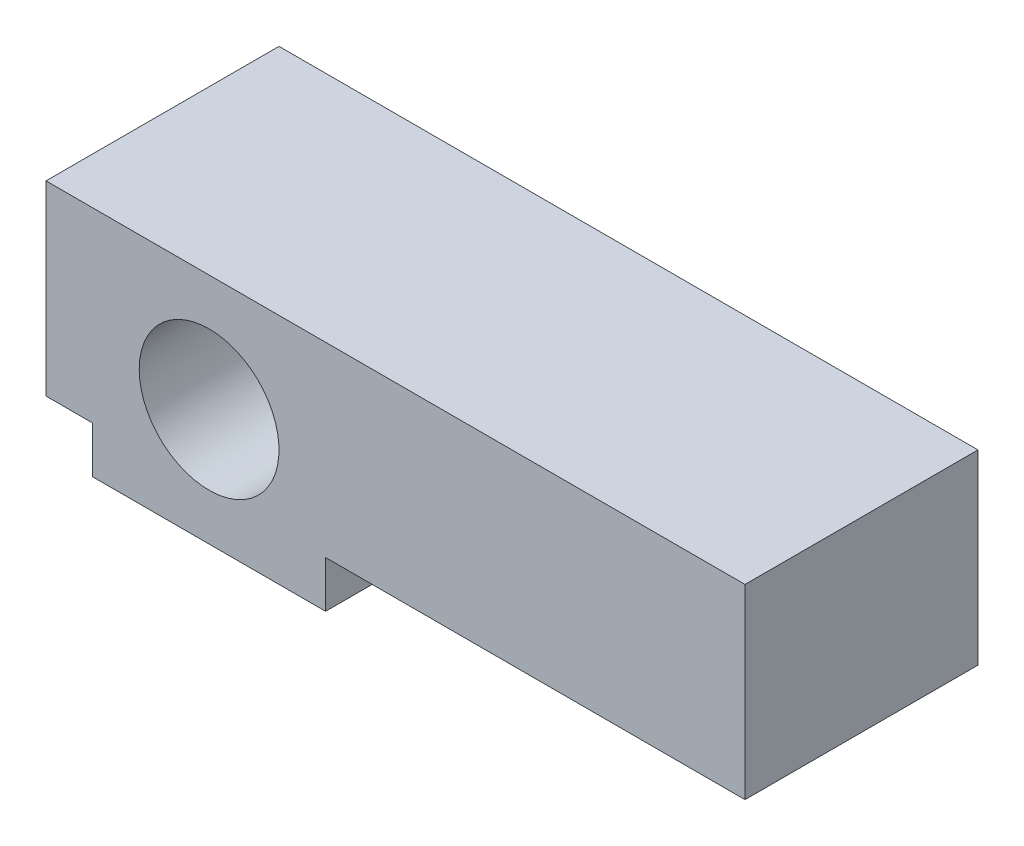
from build123d import *

# Parameters (mm, degrees)
EXTRUDE_1_DEPTH     = 10
CUT_EXTRUDE_1_REACH = 21.9
SKETCH_3_R          = 3
SKETCH_4_W          = 10
SKETCH_4_H          = 8
EXTRUDE_2_DEPTH     = 16


with BuildPart() as part:
    # 草图2 → 凸台-拉伸1 (new body)
    with BuildSketch(Plane(origin=(0, 0, 95), x_dir=(-1, 0, 0), z_dir=(0, 0, -1))):
        Polygon((2, -10), (12, -10), (12, -8), (14, -8), (14, 0), (0, 0), (0, -8), (2, -8), align=None)
    extrude(amount=EXTRUDE_1_DEPTH)

    # 草图3 → 切除-拉伸1 (cut, up to next)
    with BuildSketch(Plane(origin=(0, 0, 85), x_dir=(-1, 0, 0), z_dir=(0, 0, -1)), mode=Mode.PRIVATE) as cut_extrude_1_sk1:
        with Locations((7, -5)):
            Circle(SKETCH_3_R)
    cut_extrude_1_tool1 = extrude(cut_extrude_1_sk1.sketch, amount=-CUT_EXTRUDE_1_REACH, mode=Mode.PRIVATE) & part.part
    add(cut_extrude_1_tool1.solids().sort_by_distance((-7, -5, 85))[0], mode=Mode.SUBTRACT)

    # 草图4 → 凸台-拉伸2 (add)
    with BuildSketch(Plane(origin=(0, 0, 0), x_dir=(0, 0, -1), z_dir=(1, 0, 0))):
        with Locations((-90, -4)):
            Rectangle(SKETCH_4_W, SKETCH_4_H)
    extrude(amount=EXTRUDE_2_DEPTH)


solid = part.part
